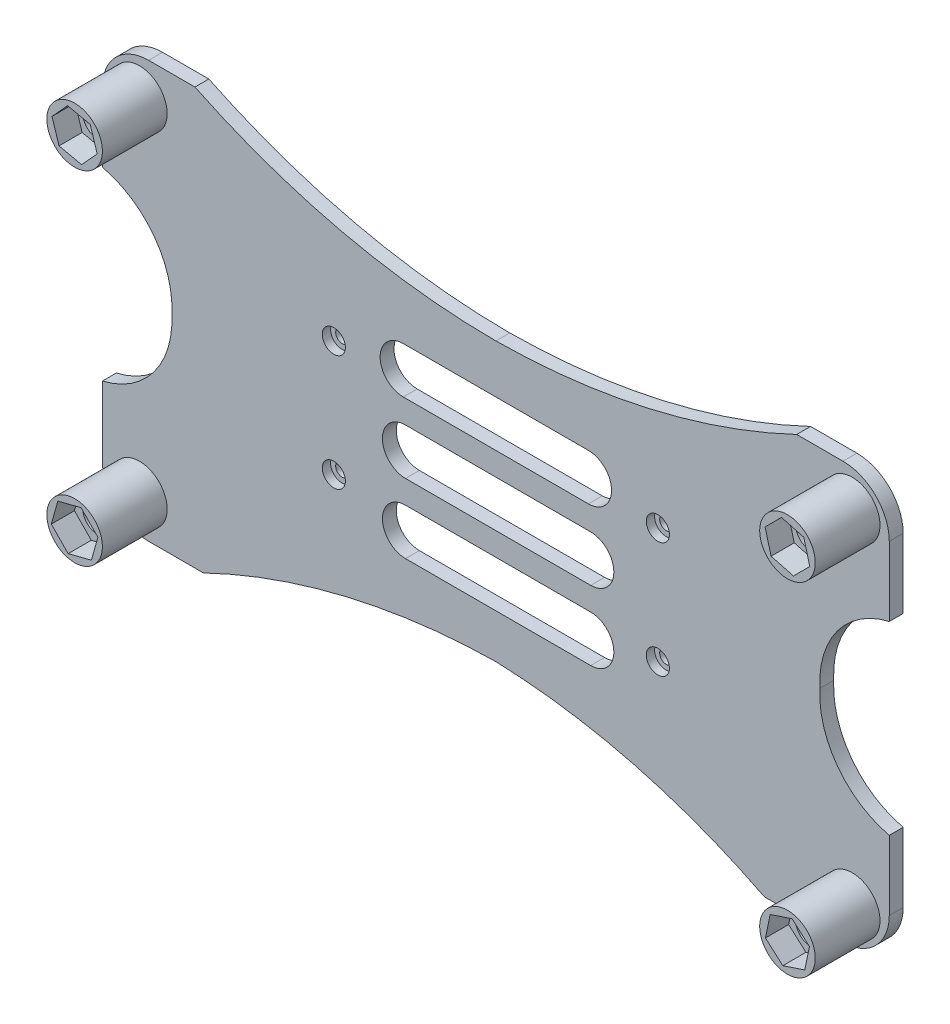
from build123d import *

# Parameters (mm, degrees)
EXTRUDE_1_DEPTH          = 3
CUT_EXTRUDE_1_DEPTH      = 42
CUT_EXTRUDE_1_DEPTH_BACK = 10
SKETCH_2_R               = 1.4
SKETCH_3_R               = 2.5
CUT_EXTRUDE_2_DEPTH      = 1.8
SKETCH_7_R               = 6
EXTRUDE_4_DEPTH          = 14
BUTTON_LEFT_NUT_DEPTH    = 5
UP_LEFT_NUT_DEPTH        = 5
UP_RIGHT_NUT_DEPTH       = 5
BUTTON_RIGHT_NUT_DEPTH   = 5
SKETCH_13_R              = 3.25
CUT_EXTRUDE_7_DEPTH      = 13
SKETCH_15_R              = 3.25
CUT_EXTRUDE_8_DEPTH      = 13
SKETCH_16_R              = 3.25
CUT_EXTRUDE_9_DEPTH      = 13
SKETCH_17_R              = 3.25
CUT_EXTRUDE_10_DEPTH     = 13


with BuildPart() as part:
    # 草图1 → 凸台-拉伸1 (new body)
    with BuildSketch(Plane.XY):
        with BuildLine():
            Line((-72.574116531, 45.487390308), (77.425883469, 45.487390308))
            ThreePointArc((77.425883469, 45.487390308), (84.496951281, 42.558458119), (87.425883469, 35.487390308))
            Line((87.425883469, 35.487390308), (87.425883469, -34.512609692))
            ThreePointArc((87.425883469, -34.512609692), (84.496951281, -41.583677504), (77.425883469, -44.512609692))
            Line((77.425883469, -44.512609692), (-72.574116531, -44.512609692))
            ThreePointArc((-72.574116531, -44.512609692), (-79.645184343, -41.583677504), (-82.574116531, -34.512609692))
            Line((-82.574116531, -34.512609692), (-82.574116531, 35.487390308))
            ThreePointArc((-82.574116531, 35.487390308), (-79.645184343, 42.558458119), (-72.574116531, 45.487390308))
        make_face()
    extrude(amount=EXTRUDE_1_DEPTH)

    # 草图2 → 切除-拉伸1 (cut, two sides: drawn at the far end of the back side and taken through both)
    with BuildSketch(Plane.XY.offset(3).offset(-CUT_EXTRUDE_1_DEPTH_BACK)):
        with Locations((-32.574116531, 12.987390308)):
            Circle(SKETCH_2_R)
        with Locations((-32.574116531, -12.012609692)):
            Circle(SKETCH_2_R)
        with Locations((37.425883469, 12.987390308)):
            Circle(SKETCH_2_R)
        with Locations((37.425883469, -12.012609692)):
            Circle(SKETCH_2_R)
        with BuildLine():
            Line((-60.749662301, -44.512609692), (60.437772164, -44.512609692))
            ThreePointArc((60.437772164, -44.512609692), (32.253211404, -33.835942142), (2.425883469, -29.512609692))
            ThreePointArc((2.425883469, -29.512609692), (-29.983273004, -33.55318593), (-60.749662301, -44.512609692))
        make_face()
        with BuildLine():
            Line((-62.574116531, 45.487390308), (67.425883469, 45.487390308))
            ThreePointArc((67.425883469, 45.487390308), (35.747267057, 34.428061428), (2.425883469, 30.487390308))
            ThreePointArc((2.425883469, 30.487390308), (-30.918540876, 34.328218147), (-62.574116531, 45.487390308))
        make_face()
        with BuildLine():
            Line((87.425883469, 20.487390308), (87.425883469, -19.512609692))
            ThreePointArc((87.425883469, -19.512609692), (76.286181126, -12.242386449), (72.425883469, 0.487390308))
            ThreePointArc((72.425883469, 0.487390308), (76.286181126, 13.217167065), (87.425883469, 20.487390308))
        make_face()
        with BuildLine():
            Line((-82.574116531, 20.487390308), (-82.574116531, -19.512609692))
            ThreePointArc((-82.574116531, -19.512609692), (-71.434414188, -12.242386449), (-67.574116531, 0.487390308))
            ThreePointArc((-67.574116531, 0.487390308), (-71.434414188, 13.217167065), (-82.574116531, 20.487390308))
        make_face()
        with BuildLine():
            Line((-17.574116531, 20), (22.425883469, 20))
            ThreePointArc((22.425883469, 20), (27.425883469, 15), (22.425883469, 10))
            Line((22.425883469, 10), (-17.574116531, 10))
            ThreePointArc((-17.574116531, 10), (-22.574116531, 15), (-17.574116531, 20))
        make_face()
        with BuildLine():
            Line((-17.079364826, 5), (22.920635174, 5))
            ThreePointArc((22.920635174, 5), (27.920635174, 0), (22.920635174, -5))
            Line((22.920635174, -5), (-17.079364826, -5))
            ThreePointArc((-17.079364826, -5), (-22.079364826, 0), (-17.079364826, 5))
        make_face()
        with BuildLine():
            Line((-17.079364826, -10), (22.920635174, -10))
            ThreePointArc((22.920635174, -10), (27.920635174, -15), (22.920635174, -20))
            Line((22.920635174, -20), (-17.079364826, -20))
            ThreePointArc((-17.079364826, -20), (-22.079364826, -15), (-17.079364826, -10))
        make_face()
    extrude(amount=CUT_EXTRUDE_1_DEPTH + CUT_EXTRUDE_1_DEPTH_BACK, mode=Mode.SUBTRACT)

    # 草图3 → 切除-拉伸2 (cut)
    with BuildSketch(Plane.XY.offset(3)):
        with Locations((-32.574116531, 12.987390308)):
            Circle(SKETCH_3_R)
        with Locations((37.425883469, 12.987390308)):
            Circle(SKETCH_3_R)
        with Locations((37.425883469, -12.012609692)):
            Circle(SKETCH_3_R)
        with Locations((-32.574116531, -12.012609692)):
            Circle(SKETCH_3_R)
    extrude(amount=-CUT_EXTRUDE_2_DEPTH, mode=Mode.SUBTRACT)

    # 草图7 → 凸台-拉伸4 (add)
    with BuildSketch(Plane.XY.offset(3)):
        with Locations(Location((-74.574116531, 37.487390308, 0), (0, 0, 180))):
            Circle(SKETCH_7_R)
        with Locations(Location((-74.574116531, -36.512609692, 0), (0, 0, 180))):
            Circle(SKETCH_7_R)
        with Locations(Location((79.425883469, 37.487390308, 0), (0, 0, 180))):
            Circle(SKETCH_7_R)
        with Locations(Location((79.425883469, -36.512609692, 0), (0, 0, 180))):
            Circle(SKETCH_7_R)
    extrude(amount=EXTRUDE_4_DEPTH)

    # 草图9 → button left nut (cut)
    with BuildSketch(Plane.XY.offset(17)):
        Polygon((-70.944636645, -40.226166125), (-69.543342379, -35.226166125), (-73.172822265, -31.512609692), (-78.203596417, -32.79905326), (-79.604890683, -37.79905326), (-75.975410797, -41.512609692), align=None)
    extrude(amount=-BUTTON_LEFT_NUT_DEPTH, mode=Mode.SUBTRACT)

    # 草图10 → up left nut (cut)
    with BuildSketch(Plane.XY.offset(17)):
        Polygon((-73.060671646, 32.721943363), (-69.690395974, 36.415348553), (-71.203840859, 41.180795498), (-76.087561416, 42.252837252), (-79.457837088, 38.559432062), (-77.944392202, 33.793985117), align=None)
    extrude(amount=-UP_LEFT_NUT_DEPTH, mode=Mode.SUBTRACT)

    # 草图11 → up right nut (cut)
    with BuildSketch(Plane.XY.offset(17)):
        Polygon((80.72901693, 32.660192033), (84.257926534, 36.202337852), (82.954793074, 41.029536126), (78.122750008, 42.314588582), (74.593840404, 38.772442763), (75.896973864, 33.945244489), align=None)
    extrude(amount=-UP_RIGHT_NUT_DEPTH, mode=Mode.SUBTRACT)

    # 草图12 → button right nut (cut)
    with BuildSketch(Plane.XY.offset(17)):
        Polygon((83.162930062, -39.834428887), (84.171186575, -34.937142005), (80.434139981, -31.61532281), (75.688836876, -33.190790498), (74.680580363, -38.08807738), (78.417626957, -41.409896575), align=None)
    extrude(amount=-BUTTON_RIGHT_NUT_DEPTH, mode=Mode.SUBTRACT)

    # 草图13 → 切除-拉伸7 (cut)
    with BuildSketch(Plane.XY.offset(17)):
        with Locations((-74.574116531, -36.512609692)):
            Circle(SKETCH_13_R)
    extrude(amount=-CUT_EXTRUDE_7_DEPTH, mode=Mode.SUBTRACT)

    # 草图15 → 切除-拉伸8 (cut)
    with BuildSketch(Plane.XY.offset(17)):
        with Locations((-74.574116531, 37.487390308)):
            Circle(SKETCH_15_R)
    extrude(amount=-CUT_EXTRUDE_8_DEPTH, mode=Mode.SUBTRACT)

    # 草图16 → 切除-拉伸9 (cut)
    with BuildSketch(Plane.XY.offset(17)):
        with Locations((79.425883469, 37.487390308)):
            Circle(SKETCH_16_R)
    extrude(amount=-CUT_EXTRUDE_9_DEPTH, mode=Mode.SUBTRACT)

    # 草图17 → 切除-拉伸10 (cut)
    with BuildSketch(Plane.XY.offset(17)):
        with Locations((79.425883469, -36.512609692)):
            Circle(SKETCH_17_R)
    extrude(amount=-CUT_EXTRUDE_10_DEPTH, mode=Mode.SUBTRACT)


solid = part.part
